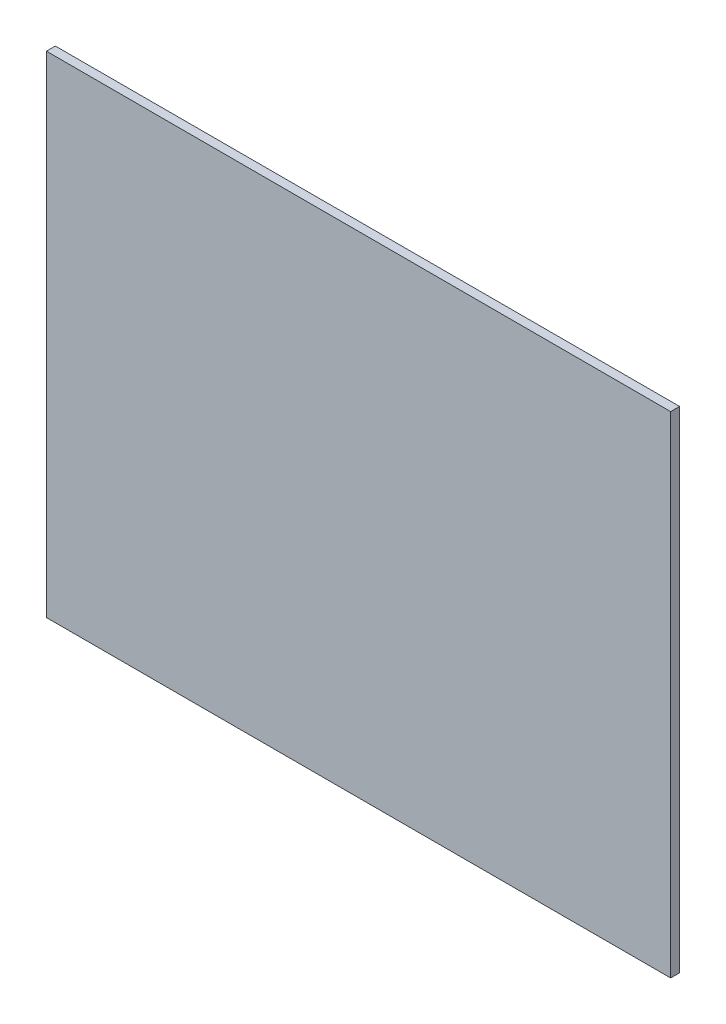
from build123d import *

# Parameters (mm, degrees)
SKETCH1_W           = 355.6
SKETCH1_H           = 279.4
BOSS_EXTRUDE1_DEPTH = 5.08


with BuildPart() as part:
    # Sketch1 → Boss-Extrude1 (new body)
    with BuildSketch(Plane.XY):
        with Locations((177.8, 139.7)):
            Rectangle(SKETCH1_W, SKETCH1_H)
    extrude(amount=BOSS_EXTRUDE1_DEPTH)


solid = part.part
